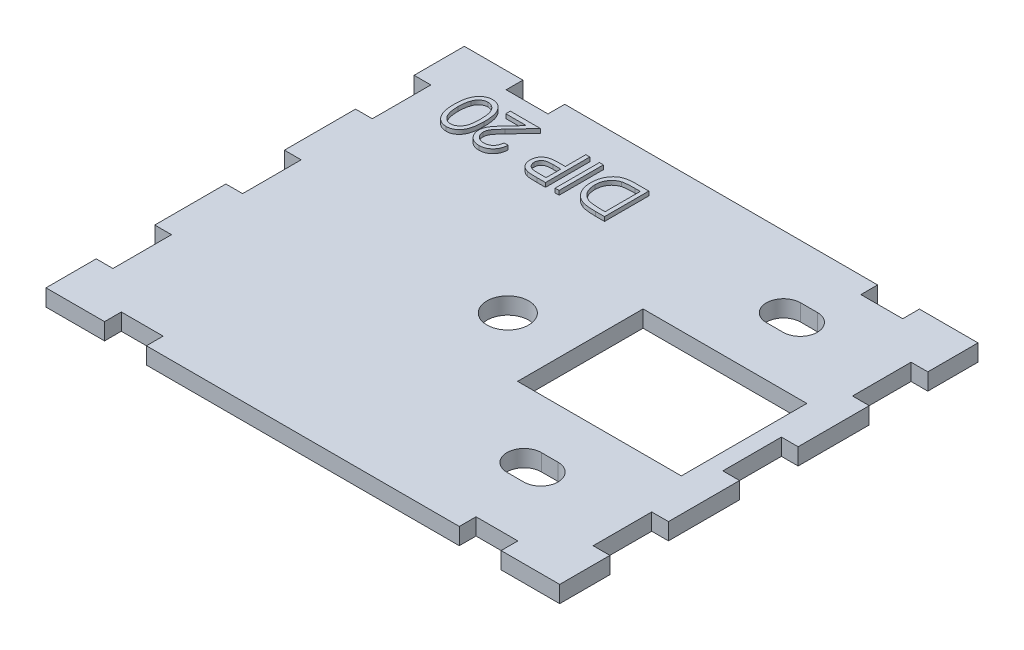
from build123d import *

# Parameters (mm, degrees)
SKETCH2_W           = 100
SKETCH2_H           = 50
BOSS_EXTRUDE1_DEPTH = 2
SKETCH12_W          = 9.8
SKETCH12_H          = 50
SKETCH12_W_2        = 8.8
CUT_EXTRUDE8_DEPTH  = 6
SKETCH13_W          = 2
SKETCH13_H          = 7
SKETCH13_W_2        = 5
SKETCH13_H_2        = 2
CUT_EXTRUDE10_DEPTH = 6
SKETCH15_W          = 6.543059906
SKETCH15_H          = 1
CUT_EXTRUDE13_DEPTH = 10
SKETCH16_R          = 2.5
CUT_EXTRUDE14_DEPTH = 10
SKETCH17_R          = 2.05
CUT_EXTRUDE15_DEPTH = 3.5
SKETCH22_W          = 0.474893162
SKETCH22_H          = 5.291666667
BOSS_EXTRUDE4_DEPTH = 0.5


with BuildPart() as part:
    # Sketch2 → Boss-Extrude1 (new body)
    with BuildSketch(Plane(origin=(0, 0, 0), x_dir=(1, 0, 0), z_dir=(0, 1, 0))):
        Rectangle(SKETCH2_W, SKETCH2_H)
    extrude(amount=BOSS_EXTRUDE1_DEPTH)

    # Sketch12 → Cut-Extrude8 (cut)
    with BuildSketch(Plane(origin=(0, 2, 0), x_dir=(1, 0, 0), z_dir=(0, 1, 0))):
        with Locations((-45.1, 0)):
            Rectangle(SKETCH12_W, SKETCH12_H)
        with Locations((45.6, 0)):
            Rectangle(SKETCH12_W_2, SKETCH12_H)
    extrude(amount=-CUT_EXTRUDE8_DEPTH, mode=Mode.SUBTRACT)

    # Sketch13 → Cut-Extrude10 (cut)
    with BuildSketch(Plane(origin=(0, 2, 0), x_dir=(1, 0, 0), z_dir=(0, 1, 0))):
        with Locations((-29.2, 0)):
            Rectangle(SKETCH13_W, SKETCH13_H)
        Polygon((-30.2, 12), (-30.2, 19), (-30.2, 25), (-40.2, 25), (-40.2, -25), (-30.2, -25), (-30.2, -19), (-30.2, -12), (-30.2, -3.5), (-30.2, 3.5), align=None)
        with Locations((-29.2, 15.5)):
            Rectangle(SKETCH13_W, SKETCH13_H)
        with Locations((21.7, -24)):
            Rectangle(SKETCH13_W_2, SKETCH13_H_2)
        with Locations((30.2, -15.5)):
            Rectangle(SKETCH13_W, SKETCH13_H)
        with Locations((30.2, 0)):
            Rectangle(SKETCH13_W, SKETCH13_H)
        with Locations((30.2, 15.5)):
            Rectangle(SKETCH13_W, SKETCH13_H)
        with Locations((21.7, 24)):
            Rectangle(SKETCH13_W_2, SKETCH13_H_2)
        with Locations((-29.2, -15.5)):
            Rectangle(SKETCH13_W, SKETCH13_H)
        Polygon((41.2, 25), (31.2, 25), (31.2, 19), (31.2, 12), (31.2, 3.5), (31.2, -3.5), (31.2, -12), (31.2, -19), (31.2, -25), (41.2, -25), align=None)
        with Locations((-20.7, 24)):
            Rectangle(SKETCH13_W_2, SKETCH13_H_2)
        with Locations((-20.7, -24)):
            Rectangle(SKETCH13_W_2, SKETCH13_H_2)
    extrude(amount=-CUT_EXTRUDE10_DEPTH, mode=Mode.SUBTRACT)

    # Sketch15 → Cut-Extrude13 (cut)
    with BuildSketch(Plane.XZ):
        Polygon((8.96933351, -7.5), (14.181143059, -7.5), (20.724202965, -7.5), (25.936012514, -7.5), (25.936012514, 5.5), (8.96933351, 5.5), align=None)
        Polygon((27.239237886, -8.5), (20.724202965, -8.5), (20.724202965, -7.5), (25.936012514, -7.5), (25.936012514, 5.5), (8.96933351, 5.5), (8.96933351, -7.5), (14.181143059, -7.5), (14.181143059, -8.5), (7.666108138, -8.5), (7.666108138, 6.5), (27.239237886, 6.5), align=None)
        with Locations((17.452673012, -8)):
            Rectangle(SKETCH15_W, SKETCH15_H)
    extrude(amount=-CUT_EXTRUDE13_DEPTH, mode=Mode.SUBTRACT)

    # Sketch16 → Cut-Extrude14 (cut)
    with BuildSketch(Plane(origin=(0, 0, 0), x_dir=(-1, 0, 0), z_dir=(0, -1, 0))):
        with Locations(Location((0, 0, 0), (0, 0, 90))):
            Circle(SKETCH16_R)
    extrude(amount=-CUT_EXTRUDE14_DEPTH, mode=Mode.SUBTRACT)

    # Sketch17 → Cut-Extrude15 (cut)
    with BuildSketch(Plane(origin=(0, 0, 0), x_dir=(-1, 0, 0), z_dir=(0, -1, 0))):
        with Locations((-18.452672908, -14.5)):
            Circle(SKETCH17_R)
        with Locations((-17.452672908, -14.5)):
            Circle(SKETCH17_R)
        with Locations((-16.452672908, -14.5)):
            Circle(SKETCH17_R)
        with BuildLine():
            ThreePointArc((-16.952672908, -12.511910465), (-16.704582071, -12.46553649), (-16.452672908, -12.45))
            Line((-16.452672908, -12.45), (-17.452672908, -12.45))
            ThreePointArc((-17.452672908, -12.45), (-17.200763745, -12.46553649), (-16.952672908, -12.511910465))
        make_face()
        with BuildLine():
            ThreePointArc((-17.952672908, -12.511910465), (-17.704582071, -12.46553649), (-17.452672908, -12.45))
            Line((-17.452672908, -12.45), (-18.452672908, -12.45))
            ThreePointArc((-18.452672908, -12.45), (-18.200763745, -12.46553649), (-17.952672908, -12.511910465))
        make_face()
        with BuildLine():
            Line((-17.452672856, -16.55), (-16.452672908, -16.55))
            ThreePointArc((-16.452672908, -16.55), (-16.704582071, -16.53446351), (-16.952672908, -16.488089535))
            ThreePointArc((-16.952672908, -16.488089535), (-17.200763719, -16.534463507), (-17.452672856, -16.55))
        make_face()
        with BuildLine():
            ThreePointArc((-17.952672908, -16.488089535), (-18.200763745, -16.53446351), (-18.452672908, -16.55))
            Line((-18.452672908, -16.55), (-17.452672856, -16.55))
            ThreePointArc((-17.452672856, -16.55), (-17.704582045, -16.534463513), (-17.952672908, -16.488089535))
        make_face()
        with Locations((-16.452672903, 16.5)):
            Circle(SKETCH17_R)
        with Locations((-18.452672903, 16.5)):
            Circle(SKETCH17_R)
        with Locations((-17.452672903, 16.5)):
            Circle(SKETCH17_R)
        with BuildLine():
            Line((-17.452672915, 14.45), (-16.452672903, 14.45))
            ThreePointArc((-16.452672903, 14.45), (-16.704582066, 14.46553649), (-16.952672903, 14.511910465))
            ThreePointArc((-16.952672903, 14.511910465), (-17.200763746, 14.465536489), (-17.452672915, 14.45))
        make_face()
        with BuildLine():
            ThreePointArc((-17.952672903, 14.511910465), (-18.20076374, 14.46553649), (-18.452672903, 14.45))
            Line((-18.452672903, 14.45), (-17.452672915, 14.45))
            ThreePointArc((-17.452672915, 14.45), (-17.704582072, 14.465536491), (-17.952672903, 14.511910465))
        make_face()
        with BuildLine():
            ThreePointArc((-17.952672903, 18.488089535), (-17.70458205, 18.534463512), (-17.452672871, 18.55))
            Line((-17.452672871, 18.55), (-18.452672903, 18.55))
            ThreePointArc((-18.452672903, 18.55), (-18.20076374, 18.53446351), (-17.952672903, 18.488089535))
        make_face()
        with BuildLine():
            ThreePointArc((-16.952672903, 18.488089535), (-16.704582066, 18.53446351), (-16.452672903, 18.55))
            Line((-16.452672903, 18.55), (-17.452672871, 18.55))
            ThreePointArc((-17.452672871, 18.55), (-17.200763724, 18.534463508), (-16.952672903, 18.488089535))
        make_face()
    extrude(amount=-CUT_EXTRUDE15_DEPTH, mode=Mode.SUBTRACT)

    # Sketch22 → Boss-Extrude4 (add)
    # profile 1 of 5: a face of its own
    with BuildSketch(Plane(origin=(0, 2, 0), x_dir=(1, 0, 0), z_dir=(0, 1, 0))):
        with BuildLine():
            add(Edge.make_bspline(
                [(-20.716744497, 17.89613181), (-20.717240429, 17.811317902), (-20.718203785, 17.646565664), (-20.728920802, 17.406498408), (-20.746723997, 17.181284636), (-20.771122173, 16.970913576), (-20.800812912, 16.775330893), (-20.840448286, 16.595059348), (-20.88552222, 16.429264292), (-20.937762848, 16.277406069), (-20.996706535, 16.137435374), (-21.060870631, 16.006775841), (-21.132757353, 15.885583552), (-21.208413198, 15.772072887), (-21.290485981, 15.667386181), (-21.378690291, 15.571993917), (-21.47224922, 15.484417849), (-21.571605461, 15.406098053), (-21.675812025, 15.337852799), (-21.781786347, 15.27599002), (-21.892551031, 15.227054855), (-22.005374005, 15.185209652), (-22.12116426, 15.152062597), (-22.239972236, 15.129006218), (-22.361904547, 15.114581657), (-22.444198293, 15.113196924), (-22.485933533, 15.112494657)],
                knots=[0, 0, 0, 0, 1.64625301, 3.197870201, 4.6634513, 6.030635694, 7.308242971, 8.501545196, 9.611429483, 10.641742253, 11.616230371, 12.55791849, 13.464870342, 14.34944951, 15.20427819, 16.044004467, 16.869007726, 17.689551165, 18.496129964, 19.285613293, 20.0683943, 20.843080271, 21.620342827, 22.403213977, 23.190190624, 24, 24, 24, 24], degree=3))
            add(Edge.make_bspline(
                [(-22.485933533, 15.112494657), (-22.528038535, 15.11307863), (-22.61181267, 15.114240531), (-22.73522212, 15.130594984), (-22.856481988, 15.15170415), (-22.973752523, 15.185559777), (-23.089251084, 15.226072425), (-23.200105454, 15.27952822), (-23.310229379, 15.337665549), (-23.414620076, 15.408588199), (-23.516396548, 15.486969399), (-23.611801364, 15.575952099), (-23.703273327, 15.673073693), (-23.787357576, 15.780500278), (-23.867657845, 15.896584684), (-23.941125855, 16.022300034), (-24.009289607, 16.157367724), (-24.073430397, 16.301161602), (-24.129519825, 16.457522624), (-24.179387809, 16.625475525), (-24.220263061, 16.806541201), (-24.254066175, 16.999711), (-24.280303826, 17.205941883), (-24.299399145, 17.424816002), (-24.309489362, 17.656470288), (-24.311389212, 17.814854229), (-24.312364155, 17.89613181)],
                knots=[0, 0, 0, 0, 0.810910589, 1.61342667, 2.396193133, 3.181089899, 3.963115317, 4.752255436, 5.550715454, 6.36105385, 7.181178335, 8.024612154, 8.872680183, 9.750181803, 10.651284446, 11.591556747, 12.554036451, 13.566402641, 14.62422919, 15.753422176, 16.94128843, 18.199818041, 19.531985927, 20.947085226, 22.433341622, 24, 24, 24, 24], degree=3))
            add(Edge.make_bspline(
                [(-24.312364155, 17.89613181), (-24.311366549, 17.977053851), (-24.309418403, 18.135080094), (-24.299628784, 18.365707085), (-24.279791944, 18.583386863), (-24.255614422, 18.788434807), (-24.220755165, 18.980582884), (-24.181946396, 19.160863002), (-24.132443633, 19.327581214), (-24.077684634, 19.482601945), (-24.014436319, 19.625786699), (-23.946785923, 19.760296874), (-23.872221202, 19.885298761), (-23.793461748, 20.00211897), (-23.707785617, 20.108624237), (-23.617551542, 20.206832254), (-23.521221151, 20.29596955), (-23.41892076, 20.37527622), (-23.313543383, 20.446733125), (-23.203397989, 20.506943454), (-23.091062981, 20.559434574), (-22.975369929, 20.601631296), (-22.857056574, 20.63498797), (-22.73569685, 20.657695354), (-22.611796166, 20.673701201), (-22.528033014, 20.674917521), (-22.485933533, 20.675528845)],
                knots=[0, 0, 0, 0, 1.561431216, 3.049195289, 4.452146966, 5.778046447, 7.031138842, 8.218704273, 9.334037798, 10.384210803, 11.388620812, 12.352076869, 13.287433199, 14.19507451, 15.06813243, 15.922055533, 16.766344942, 17.596869952, 18.417486629, 19.220035357, 20.016159057, 20.807716045, 21.59340902, 22.384936649, 23.188266813, 24, 24, 24, 24], degree=3))
            add(Edge.make_bspline(
                [(-22.485933533, 20.675528845), (-22.444199748, 20.674820354), (-22.361908869, 20.673423348), (-22.239955549, 20.659088686), (-22.121319838, 20.63571368), (-22.005764569, 20.603970543), (-21.893053284, 20.563626881), (-21.784289992, 20.512311299), (-21.678038718, 20.45279298), (-21.574782726, 20.385080615), (-21.476495962, 20.307480717), (-21.382592523, 20.221669977), (-21.295530267, 20.125436959), (-21.21402349, 20.020317616), (-21.137739906, 19.906521207), (-21.066157605, 19.784401125), (-21.002188911, 19.652468745), (-20.941908745, 19.51173821), (-20.888771319, 19.358764172), (-20.842372699, 19.19240096), (-20.803254441, 19.011513823), (-20.772096202, 18.816094102), (-20.746570656, 18.60644432), (-20.728938353, 18.382230389), (-20.718209143, 18.143932555), (-20.717241621, 17.980239371), (-20.716744497, 17.89613181)],
                knots=[0, 0, 0, 0, 0.810976328, 1.599087026, 2.383086309, 3.159618043, 3.926613167, 4.707144544, 5.494386734, 6.292609454, 7.104690378, 7.92621526, 8.762510248, 9.62398222, 10.509836085, 11.424023232, 12.373226806, 13.358118208, 14.398657954, 15.5185989, 16.713620699, 17.994156382, 19.364120462, 20.818119981, 22.365111093, 24, 24, 24, 24], degree=3))
        make_face()
        with BuildLine():
            add(Edge.make_bspline(
                [(-21.191637659, 17.894011751), (-21.191822212, 17.964691049), (-21.192180392, 18.101865687), (-21.2012668, 18.300851742), (-21.213914152, 18.48675787), (-21.229825254, 18.659511508), (-21.253654372, 18.818508909), (-21.280690025, 18.96441101), (-21.313117431, 19.096947986), (-21.351674753, 19.217277274), (-21.395592975, 19.327105405), (-21.443467732, 19.42935062), (-21.495326441, 19.52525658), (-21.552358895, 19.614477255), (-21.615382206, 19.696514328), (-21.682989671, 19.771757419), (-21.755574408, 19.839900159), (-21.856031538, 19.920771784), (-21.988008519, 20.00532598), (-22.155144168, 20.078050624), (-22.326959281, 20.124048831), (-22.443609989, 20.129882191), (-22.501833973, 20.132793802)],
                knots=[0, 0, 0, 0, 1.459193451, 2.832007961, 4.111736495, 5.306635028, 6.412683014, 7.430020708, 8.369596877, 9.227877302, 10.036669781, 10.810175692, 11.557788084, 12.286326232, 12.994037279, 13.69140682, 14.37267704, 15.047194847, 16.352618509, 17.594157723, 18.799169539, 20, 20, 20, 20], degree=3))
            add(Edge.make_bspline(
                [(-22.501833973, 20.132793802), (-22.56039229, 20.130240718), (-22.677301204, 20.125143607), (-22.848999369, 20.080658026), (-23.014305724, 20.008338599), (-23.144763746, 19.925715368), (-23.243738474, 19.846526797), (-23.314678398, 19.779088769), (-23.379782473, 19.703556066), (-23.441532256, 19.622066628), (-23.498166684, 19.533056715), (-23.549666941, 19.436956247), (-23.596661992, 19.333497821), (-23.623436384, 19.261274529), (-23.63712544, 19.224348623)],
                knots=[0, 0, 0, 0, 1.353621445, 2.702441307, 4.075953605, 5.516772412, 6.261413105, 7.007624062, 7.778524365, 8.566925914, 9.372323995, 10.217594641, 11.088702136, 12, 12, 12, 12], degree=3))
            add(Edge.make_bspline(
                [(-23.63712544, 19.224348623), (-23.653078708, 19.177132231), (-23.685470683, 19.081262707), (-23.727217056, 18.932546233), (-23.760094029, 18.776513483), (-23.789671975, 18.614096937), (-23.809860524, 18.444098818), (-23.826110194, 18.267045118), (-23.83568159, 18.082802344), (-23.836868058, 17.957624203), (-23.837470993, 17.894011751)],
                knots=[0, 0, 0, 0, 0.884706709, 1.796334032, 2.740027952, 3.714592787, 4.726048262, 5.777819803, 6.87074269, 8, 8, 8, 8], degree=3))
            add(Edge.make_bspline(
                [(-23.837470993, 17.894011751), (-23.836806021, 17.830400666), (-23.835505032, 17.705948393), (-23.826957421, 17.523874605), (-23.81322212, 17.350641552), (-23.794631691, 17.186092084), (-23.769110968, 17.030519074), (-23.738463103, 16.883699921), (-23.702532053, 16.745674134), (-23.661317876, 16.616086003), (-23.614870734, 16.495400447), (-23.563558283, 16.383357672), (-23.508808846, 16.279353378), (-23.449303872, 16.183722088), (-23.385885258, 16.095905788), (-23.316275862, 16.017925955), (-23.244897219, 15.945989087), (-23.143381683, 15.865342559), (-23.01156069, 15.782464935), (-22.846399369, 15.708270645), (-22.675464524, 15.664360462), (-22.559669092, 15.658271093), (-22.501833973, 15.655229699)],
                knots=[0, 0, 0, 0, 1.313528337, 2.569860077, 3.762944266, 4.901481389, 5.988248151, 7.017139294, 7.997571128, 8.932104357, 9.823695246, 10.66607014, 11.475539426, 12.248954257, 12.990316782, 13.708962568, 14.405488541, 15.08007697, 16.381737273, 17.610043218, 18.806313575, 20, 20, 20, 20], degree=3))
            add(Edge.make_bspline(
                [(-22.501833973, 15.655229699), (-22.443295893, 15.658274691), (-22.326113091, 15.664370222), (-22.153390072, 15.708115723), (-21.987240021, 15.781937242), (-21.855696818, 15.865445044), (-21.755610415, 15.945675891), (-21.684387143, 16.014151223), (-21.617170962, 16.088690634), (-21.554449567, 16.170355748), (-21.497765085, 16.259406295), (-21.445276081, 16.354616993), (-21.397783283, 16.456710326), (-21.353699287, 16.566477756), (-21.31555108, 16.687004767), (-21.281251394, 16.819515311), (-21.254777198, 16.966366277), (-21.231270439, 17.126110329), (-21.213502001, 17.29906936), (-21.201354945, 17.485415572), (-21.192152794, 17.685095279), (-21.19181281, 17.822978156), (-21.191637659, 17.894011751)],
                knots=[0, 0, 0, 0, 1.207779899, 2.417760083, 3.652287919, 4.947299644, 5.621638849, 6.297435916, 6.984320042, 7.691843698, 8.42018894, 9.161205785, 9.934506883, 10.743085206, 11.601138371, 12.542248028, 13.566483018, 14.679455109, 15.87477181, 17.154161492, 18.533899613, 20, 20, 20, 20], degree=3))
        make_face(mode=Mode.SUBTRACT)
    # profile 2 of 5: a face of its own
    with BuildSketch(Plane(origin=(0, 2, 0), x_dir=(1, 0, 0), z_dir=(0, 1, 0))):
        with BuildLine():
            Line((-17.32465048, 16.876383546), (-16.849757317, 16.876383546))
            add(Edge.make_bspline(
                [(-16.849757317, 16.876383546), (-16.852851891, 16.813380821), (-16.858929551, 16.689645148), (-16.887403586, 16.50924316), (-16.928108647, 16.336787262), (-16.985797214, 16.173755947), (-17.057037554, 16.018201668), (-17.144256345, 15.872190007), (-17.245594226, 15.734271816), (-17.360865287, 15.607058342), (-17.485945012, 15.490769321), (-17.620083979, 15.389285111), (-17.761903493, 15.304521907), (-17.910173472, 15.233276479), (-18.066608702, 15.179863068), (-18.229713838, 15.140213786), (-18.400226098, 15.116362725), (-18.516400763, 15.113798683), (-18.575485149, 15.112494657)],
                knots=[0, 0, 0, 0, 1.100776268, 2.161895295, 3.184016182, 4.190939212, 5.176500551, 6.166955529, 7.155448256, 8.160289653, 9.16017456, 10.133824356, 11.091467644, 12.04088621, 13.000931625, 13.972173743, 14.968683325, 16, 16, 16, 16], degree=3))
            add(Edge.make_bspline(
                [(-18.575485149, 15.112494657), (-18.633513225, 15.113842014), (-18.747536322, 15.116489523), (-18.91388184, 15.139567498), (-19.072615359, 15.174932437), (-19.221937953, 15.227337706), (-19.363382093, 15.293094856), (-19.495196463, 15.374872486), (-19.620568474, 15.468801156), (-19.733345086, 15.579594627), (-19.836944009, 15.697811541), (-19.926240018, 15.824066212), (-20.003142442, 15.954617428), (-20.066084675, 16.090484986), (-20.113797686, 16.232111336), (-20.149148455, 16.378138657), (-20.169356865, 16.530252205), (-20.172441304, 16.633225793), (-20.174009454, 16.685578257)],
                knots=[0, 0, 0, 0, 1.111674182, 2.184400057, 3.212814286, 4.223731311, 5.211378316, 6.196328225, 7.191884489, 8.207283132, 9.220262353, 10.201199469, 11.166417575, 12.120932471, 13.06540007, 14.026332106, 14.996573967, 16, 16, 16, 16], degree=3))
            add(Edge.make_bspline(
                [(-20.174009454, 16.685578257), (-20.171449362, 16.759280309), (-20.166374103, 16.905391045), (-20.12296129, 17.120104457), (-20.055155392, 17.328130833), (-19.973523766, 17.495560793), (-19.891150425, 17.630460565), (-19.816994329, 17.741585211), (-19.729688646, 17.861205092), (-19.629979277, 17.989804369), (-19.516149085, 18.125698924), (-19.391155364, 18.271661373), (-19.251770107, 18.424992768), (-19.154027533, 18.529788404), (-19.10337978, 18.584090877)],
                knots=[0, 0, 0, 0, 1.184416499, 2.348048165, 3.509039915, 4.696071444, 5.333504901, 6.05069495, 6.844171097, 7.714965912, 8.667477798, 9.695072654, 10.805644396, 12, 12, 12, 12], degree=3))
            Line((-19.10337978, 18.584090877), (-17.779403084, 19.997110041))
            Line((-17.779403084, 19.997110041), (-20.241851335, 19.997110041))
            Line((-20.241851335, 19.997110041), (-20.241851335, 20.539845084))
            Line((-20.241851335, 20.539845084), (-16.646231676, 20.539845084))
            Line((-16.646231676, 20.539845084), (-18.698448557, 18.349824384))
            add(Edge.make_bspline(
                [(-18.698448557, 18.349824384), (-18.748417352, 18.297669075), (-18.84439718, 18.1974894), (-18.980093345, 18.05118583), (-19.102166364, 17.915617358), (-19.210697214, 17.790183248), (-19.305775196, 17.675594593), (-19.387096101, 17.570953389), (-19.455019352, 17.477157637), (-19.527003845, 17.36697031), (-19.595645836, 17.232278448), (-19.655975122, 17.068505909), (-19.692497651, 16.899542096), (-19.696901246, 16.785395931), (-19.699116292, 16.727979432)],
                knots=[0, 0, 0, 0, 1.329530082, 2.553755191, 3.672934919, 4.687409497, 5.60679272, 6.413407421, 7.126401618, 7.737995624, 8.834647426, 9.90044882, 10.943907757, 12, 12, 12, 12], degree=3))
            add(Edge.make_bspline(
                [(-19.699116292, 16.727979432), (-19.698164983, 16.691869042), (-19.696290137, 16.620702398), (-19.679430288, 16.516429511), (-19.654659824, 16.415456149), (-19.616480887, 16.319030776), (-19.5706103, 16.225256891), (-19.512007243, 16.136985513), (-19.445039337, 16.051207682), (-19.367359852, 15.97086465), (-19.28208221, 15.897257956), (-19.191978454, 15.832059842), (-19.096653465, 15.777571774), (-18.996504504, 15.732904918), (-18.891812005, 15.697865922), (-18.782373149, 15.673586887), (-18.668490414, 15.658343129), (-18.590727867, 15.656280632), (-18.551104473, 15.655229699)],
                knots=[0, 0, 0, 0, 0.991504627, 1.954065223, 2.895985987, 3.842598665, 4.797835564, 5.759220273, 6.74786863, 7.784730864, 8.824135544, 9.839918996, 10.835834653, 11.835434876, 12.84861661, 13.863796685, 14.911511676, 16, 16, 16, 16], degree=3))
            add(Edge.make_bspline(
                [(-18.551104473, 15.655229699), (-18.50971181, 15.656267775), (-18.428423454, 15.658306385), (-18.309330619, 15.673757358), (-18.194924754, 15.697157069), (-18.086968824, 15.734409218), (-17.983203502, 15.778007991), (-17.886275893, 15.834460734), (-17.79346318, 15.898966722), (-17.706631391, 15.974176607), (-17.627546394, 16.059077239), (-17.555602065, 16.151490077), (-17.494642922, 16.253053412), (-17.440530105, 16.361330204), (-17.399144484, 16.479295263), (-17.363762743, 16.60406361), (-17.33806196, 16.737415395), (-17.329195224, 16.829291455), (-17.32465048, 16.876383546)],
                knots=[0, 0, 0, 0, 1.031072318, 2.024855787, 2.988461151, 3.935103592, 4.865765533, 5.788564469, 6.724086513, 7.67908574, 8.64457978, 9.611397706, 10.591395687, 11.591555111, 12.622101007, 13.700900657, 14.821571223, 16, 16, 16, 16], degree=3))
        make_face()
    # profile 3 of 5: a face of its own
    with BuildSketch(Plane(origin=(0, 2, 0), x_dir=(1, 0, 0), z_dir=(0, 1, 0))):
        with BuildLine():
            Line((-10.743988087, 15.248178417), (-11.78175685, 15.248178417))
            add(Edge.make_bspline(
                [(-11.78175685, 15.248178417), (-11.853135244, 15.24825688), (-11.989899416, 15.248407217), (-12.186016227, 15.252965225), (-12.364133321, 15.2590532), (-12.523866635, 15.267492491), (-12.66570764, 15.277465907), (-12.78901451, 15.29145411), (-12.894756458, 15.306059556), (-12.958115019, 15.320908588), (-12.987010256, 15.327680621)],
                knots=[0, 0, 0, 0, 1.415646017, 2.712440637, 3.8905458, 4.950247383, 5.884950622, 6.709939814, 7.411656543, 8, 8, 8, 8], degree=3))
            add(Edge.make_bspline(
                [(-12.987010256, 15.327680621), (-13.023588342, 15.337692681), (-13.095882598, 15.357480878), (-13.200057776, 15.39710916), (-13.299156464, 15.44411866), (-13.393593184, 15.497616299), (-13.481750128, 15.560128491), (-13.566379725, 15.628047242), (-13.64570717, 15.704119349), (-13.718534643, 15.788244656), (-13.786012442, 15.877667251), (-13.842496197, 15.974667362), (-13.892373574, 16.075880016), (-13.931243469, 16.18377635), (-13.961796699, 16.296932148), (-13.98404865, 16.415641918), (-13.998350454, 16.539649576), (-13.999707516, 16.624409671), (-14.000398343, 16.667557758)],
                knots=[0, 0, 0, 0, 0.999333726, 1.975119402, 2.933498163, 3.889020618, 4.832249799, 5.779334906, 6.747801194, 7.724875447, 8.710438469, 9.696133548, 10.679360639, 11.681339199, 12.714023775, 13.766351759, 14.862936069, 16, 16, 16, 16], degree=3))
            add(Edge.make_bspline(
                [(-14.000398343, 16.667557758), (-13.999761189, 16.711067015), (-13.998514554, 16.796195817), (-13.983552313, 16.920735628), (-13.963398333, 17.039750337), (-13.932408742, 17.152976053), (-13.891820641, 17.259740373), (-13.844207656, 17.361674855), (-13.786780176, 17.457045311), (-13.72079335, 17.546197977), (-13.647387963, 17.629216535), (-13.566874593, 17.705499379), (-13.479578281, 17.774599986), (-13.385776462, 17.836673267), (-13.284554667, 17.890279785), (-13.177448078, 17.938293806), (-13.063525727, 17.978617909), (-12.984691211, 17.999830026), (-12.94460908, 18.010614983)],
                knots=[0, 0, 0, 0, 1.121902311, 2.195077645, 3.232258892, 4.234102512, 5.217864754, 6.176164875, 7.132989551, 8.084763148, 9.034132444, 9.988522005, 10.94243251, 11.903244335, 12.886203696, 13.894208494, 14.929344452, 16, 16, 16, 16], degree=3))
            add(Edge.make_bspline(
                [(-12.94460908, 18.010614983), (-12.911456662, 18.017659712), (-12.83880121, 18.033098645), (-12.719152454, 18.050451574), (-12.579775061, 18.064682872), (-12.421143254, 18.077963633), (-12.242887108, 18.085000776), (-12.045415456, 18.09326353), (-11.828059989, 18.097162272), (-11.676461327, 18.097408721), (-11.597311738, 18.097537392)],
                knots=[0, 0, 0, 0, 0.601372724, 1.317943291, 2.144091499, 3.08771165, 4.142394186, 5.309582461, 6.595334295, 8, 8, 8, 8], degree=3))
            Line((-11.597311738, 18.097537392), (-11.218881249, 18.097537392))
            Line((-11.218881249, 18.097537392), (-11.218881249, 20.539845084))
            Line((-11.218881249, 20.539845084), (-10.743988087, 20.539845084))
            Line((-10.743988087, 20.539845084), (-10.743988087, 15.248178417))
        make_face()
        with BuildLine():
            Line((-11.218881249, 15.79091346), (-11.218881249, 17.554802349))
            Line((-11.218881249, 17.554802349), (-12.145346928, 17.566462672))
            add(Edge.make_bspline(
                [(-12.145346928, 17.566462672), (-12.190583767, 17.5664925), (-12.277912554, 17.566550082), (-12.404402284, 17.560421484), (-12.521473048, 17.553754261), (-12.629297694, 17.542971778), (-12.727384082, 17.529820509), (-12.815969692, 17.512237197), (-12.89576148, 17.494303354), (-12.987672784, 17.463184955), (-13.090623083, 17.4162389), (-13.202360616, 17.346119114), (-13.297831175, 17.257785816), (-13.379749501, 17.157394105), (-13.444500342, 17.045594913), (-13.491428084, 16.926308405), (-13.520071803, 16.799987531), (-13.523672075, 16.713641524), (-13.525505181, 16.669677816)],
                knots=[0, 0, 0, 0, 1.160501667, 2.240324542, 3.248665471, 4.168823117, 5.020172044, 5.786515869, 6.485785279, 7.116517804, 8.272762037, 9.381837012, 10.485674779, 11.594342068, 12.695271952, 13.786226926, 14.872841088, 16, 16, 16, 16], degree=3))
            add(Edge.make_bspline(
                [(-13.525505181, 16.669677816), (-13.523590293, 16.627138412), (-13.519783734, 16.54257534), (-13.491664691, 16.418581872), (-13.444003363, 16.300651465), (-13.379696713, 16.189738386), (-13.299741438, 16.089613502), (-13.206169591, 16.003248829), (-13.100437004, 15.933346739), (-13.00285022, 15.886813583), (-12.915517734, 15.859525505), (-12.840026743, 15.839824894), (-12.754356015, 15.826237802), (-12.659316318, 15.81323751), (-12.555029332, 15.802743445), (-12.44083192, 15.795456031), (-12.317104467, 15.791235826), (-12.231212697, 15.791023517), (-12.186688073, 15.79091346)],
                knots=[0, 0, 0, 0, 1.12039168, 2.227199994, 3.330242575, 4.460839274, 5.593542475, 6.693949254, 7.801736126, 8.92216649, 9.528704869, 10.210659466, 10.975987387, 11.81211542, 12.738540127, 13.736887663, 14.826846554, 16, 16, 16, 16], degree=3))
            Line((-12.186688073, 15.79091346), (-11.218881249, 15.79091346))
        make_face(mode=Mode.SUBTRACT)
    # profile 4 of 5: a face of its own
    with BuildSketch(Plane(origin=(0, 2, 0), x_dir=(1, 0, 0), z_dir=(0, 1, 0))):
        with Locations((-9.35322954, 17.89401175)):
            Rectangle(SKETCH22_W, SKETCH22_H)
    # profile 5 of 5: a face of its own
    with BuildSketch(Plane(origin=(0, 2, 0), x_dir=(1, 0, 0), z_dir=(0, 1, 0))):
        with BuildLine():
            Line((-3.688432531, 20.539845084), (-3.688432531, 15.248178417))
            Line((-3.688432531, 15.248178417), (-4.756942147, 15.248178417))
            add(Edge.make_bspline(
                [(-4.756942147, 15.248178417), (-4.849877596, 15.248845718), (-5.0294284, 15.250134939), (-5.288887489, 15.258355989), (-5.528611013, 15.272752196), (-5.748462837, 15.294126465), (-5.94879617, 15.319781578), (-6.129290156, 15.352408477), (-6.290237298, 15.39077992), (-6.389220663, 15.423507319), (-6.436028685, 15.438983706)],
                knots=[0, 0, 0, 0, 1.314317071, 2.539253741, 3.67075822, 4.709970291, 5.662644612, 6.526156501, 7.303037452, 8, 8, 8, 8], degree=3))
            add(Edge.make_bspline(
                [(-6.436028685, 15.438983706), (-6.497258349, 15.462306224), (-6.618329192, 15.508422383), (-6.790617621, 15.595547119), (-6.953357996, 15.693859614), (-7.10526531, 15.805613833), (-7.246674285, 15.929381688), (-7.379364152, 16.064161799), (-7.499531602, 16.21355234), (-7.611321246, 16.372917778), (-7.70916619, 16.543708371), (-7.795446627, 16.722503207), (-7.869117021, 16.908955371), (-7.926599717, 17.104425318), (-7.974090358, 17.307035637), (-8.005955413, 17.518320336), (-8.027122088, 17.737047608), (-8.029238844, 17.885479957), (-8.030312873, 17.960793602)],
                knots=[0, 0, 0, 0, 0.984696416, 1.947063185, 2.89840987, 3.841051395, 4.778753227, 5.721858861, 6.681155121, 7.65838316, 8.646299769, 9.637283673, 10.641736726, 11.657050558, 12.698485921, 13.768600492, 14.86780186, 16, 16, 16, 16], degree=3))
            add(Edge.make_bspline(
                [(-8.030312873, 17.960793602), (-8.029361293, 18.026200252), (-8.027486104, 18.155090889), (-8.010668821, 18.345051132), (-7.986178209, 18.529361241), (-7.948435461, 18.707211928), (-7.902058048, 18.879800613), (-7.844816495, 19.046310112), (-7.77697072, 19.206853596), (-7.698288892, 19.360155912), (-7.612135499, 19.505844287), (-7.518257235, 19.641610381), (-7.419868431, 19.768951073), (-7.313380669, 19.884989597), (-7.202319651, 19.993339426), (-7.082908037, 20.089194152), (-6.958884746, 20.177003811), (-6.826523758, 20.254101774), (-6.684739102, 20.322682703), (-6.52982716, 20.38059971), (-6.362353317, 20.430441608), (-6.181207858, 20.470152222), (-5.986994921, 20.502160991), (-5.779188037, 20.523477188), (-5.55817634, 20.53793223), (-5.406411952, 20.539195085), (-5.328297983, 20.539845084)],
                knots=[0, 0, 0, 0, 1.105894396, 2.179280415, 3.222964075, 4.248423888, 5.251546139, 6.243661943, 7.223682738, 8.196462441, 9.155694589, 10.083899862, 10.986397372, 11.874737962, 12.745335529, 13.607670254, 14.461432187, 15.313100333, 16.195087267, 17.121790994, 18.106827133, 19.14775296, 20.255889161, 21.433815148, 22.679170477, 24, 24, 24, 24], degree=3))
            Line((-5.328297983, 20.539845084), (-3.688432531, 20.539845084))
        make_face()
        with BuildLine():
            Line((-4.163325694, 19.997110041), (-4.770722528, 19.997110041))
            add(Edge.make_bspline(
                [(-4.770722528, 19.997110041), (-4.858002327, 19.996734943), (-5.025873344, 19.996013492), (-5.26726103, 19.98968284), (-5.487816784, 19.979338482), (-5.687571924, 19.964861876), (-5.866413663, 19.945708137), (-6.024715761, 19.924352629), (-6.161959306, 19.897746959), (-6.245007383, 19.873630628), (-6.283384454, 19.86248631)],
                knots=[0, 0, 0, 0, 1.375205317, 2.645023457, 3.804390687, 4.853969522, 5.800190428, 6.637939096, 7.370582563, 8, 8, 8, 8], degree=3))
            add(Edge.make_bspline(
                [(-6.283384454, 19.86248631), (-6.331688361, 19.845476297), (-6.427142438, 19.811862553), (-6.564531142, 19.750524854), (-6.692730419, 19.677957626), (-6.813877485, 19.596817328), (-6.927193768, 19.505851075), (-7.032154508, 19.404769574), (-7.129588767, 19.294743066), (-7.217936528, 19.175400814), (-7.297840069, 19.048066979), (-7.366876466, 18.912883401), (-7.425073367, 18.770608682), (-7.472820055, 18.62173782), (-7.510046099, 18.466182211), (-7.536254699, 18.30355149), (-7.552495861, 18.133909881), (-7.554434468, 18.018425372), (-7.555419711, 17.959733572)],
                knots=[0, 0, 0, 0, 0.998420628, 1.972994, 2.929372424, 3.86770908, 4.81360496, 5.759023883, 6.706048443, 7.676227424, 8.651287839, 9.634325482, 10.632389399, 11.645655052, 12.680158286, 13.74837235, 14.855672678, 16, 16, 16, 16], degree=3))
            add(Edge.make_bspline(
                [(-7.555419711, 17.959733572), (-7.554642842, 17.897846419), (-7.553116676, 17.776268559), (-7.533966052, 17.597872612), (-7.505920737, 17.426319709), (-7.46557974, 17.261486341), (-7.41346265, 17.103586959), (-7.351100328, 16.951729499), (-7.275382679, 16.807868222), (-7.189662296, 16.670784678), (-7.093425467, 16.542554911), (-6.987099095, 16.4246812), (-6.871804326, 16.316943975), (-6.748072519, 16.219171701), (-6.614173694, 16.133103123), (-6.472373682, 16.05653786), (-6.320675041, 15.991483459), (-6.215122907, 15.956895335), (-6.161481075, 15.939317573)],
                knots=[0, 0, 0, 0, 1.122272916, 2.204715076, 3.251197285, 4.274229216, 5.279697671, 6.265416158, 7.248880903, 8.225321784, 9.195852973, 10.153576302, 11.101466393, 12.055578741, 13.010401466, 13.985536859, 14.976245305, 16, 16, 16, 16], degree=3))
            add(Edge.make_bspline(
                [(-6.161481075, 15.939317573), (-6.117104938, 15.927046307), (-6.022749093, 15.900954229), (-5.868777522, 15.872492059), (-5.695490332, 15.847387638), (-5.502118165, 15.826133221), (-5.288881447, 15.810882152), (-5.05561618, 15.799435045), (-4.80222154, 15.791714303), (-4.626564614, 15.791187091), (-4.535396006, 15.79091346)],
                knots=[0, 0, 0, 0, 0.674548936, 1.434276114, 2.292660221, 3.240891867, 4.284742987, 5.42552168, 6.663806718, 8, 8, 8, 8], degree=3))
            Line((-4.535396006, 15.79091346), (-4.163325694, 15.79091346))
            Line((-4.163325694, 15.79091346), (-4.163325694, 19.997110041))
        make_face(mode=Mode.SUBTRACT)
    extrude(amount=BOSS_EXTRUDE4_DEPTH)


solid = part.part
